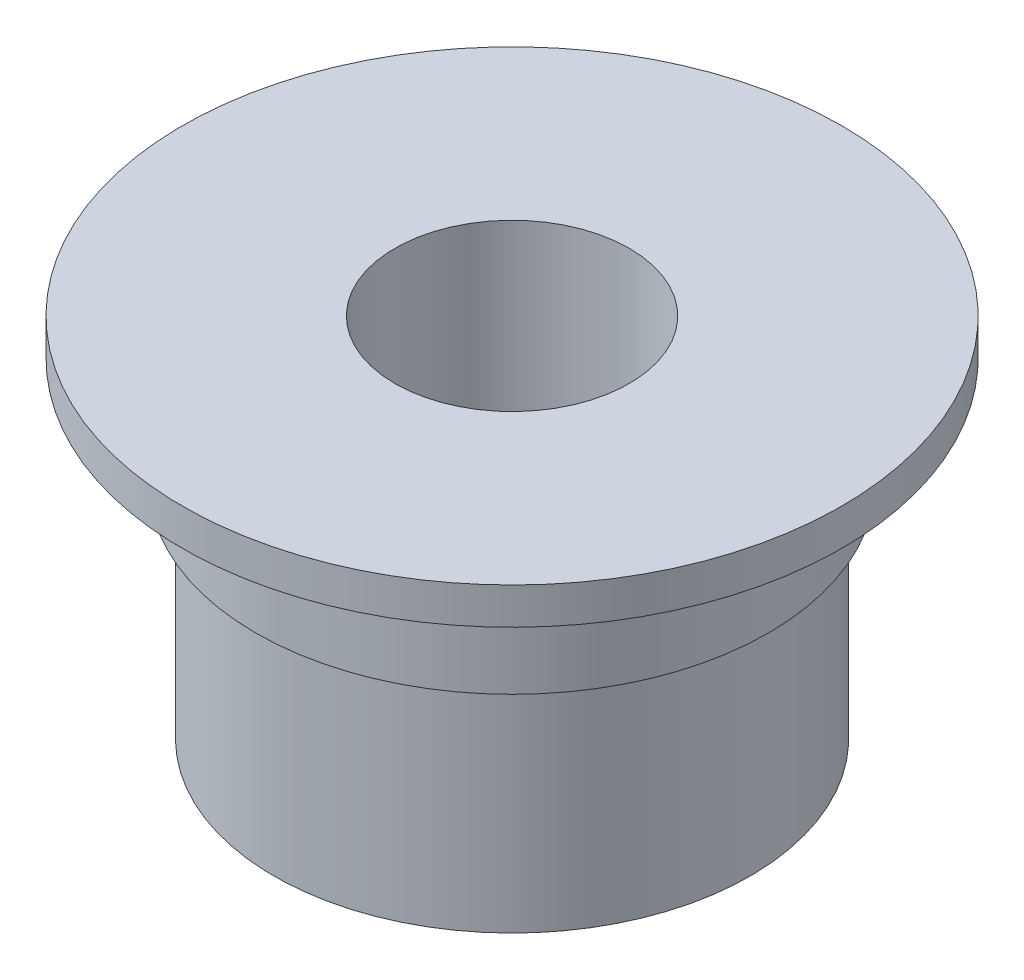
from build123d import *


with BuildPart() as part:
    # 草图1 → Cable_gland_section (revolve)
    with BuildSketch(Plane.XY, mode=Mode.PRIVATE) as cable_gland_section_sk:
        Polygon((3.2, 0), (6.5, 0), (6.5, 6), (7, 6), (7, 9), (9, 9), (9, 10), (3.2, 10), align=None)
    revolve(cable_gland_section_sk.sketch.rotate(Axis((0, 0, 0), (0, 1, 0)), 90), axis=Axis((0, 0, 0), (0, 1, 0)))


solid = part.part
